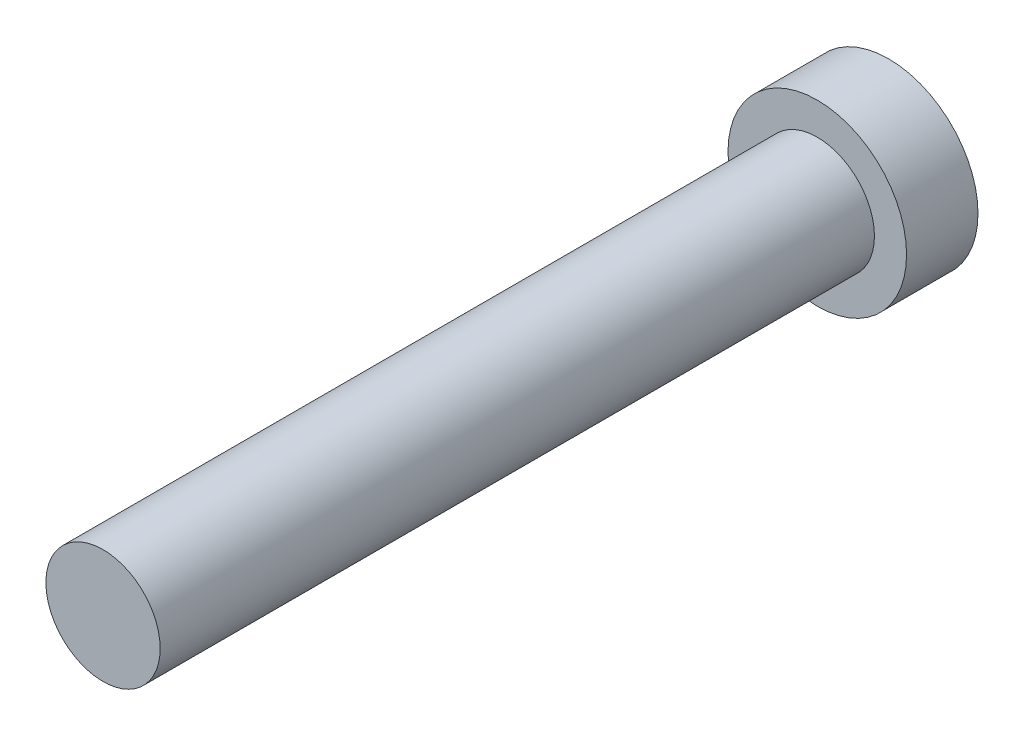
from build123d import *

# Parameters (mm, degrees)
SKETCH1_R           = 1.6
BOSS_EXTRUDE1_DEPTH = 10
SKETCH2_R           = 2.5
BOSS_EXTRUDE2_DEPTH = 2


with BuildPart() as part:
    # Sketch1 → Boss-Extrude1 (new, symmetric)
    with BuildSketch(Plane.XY):
        Circle(SKETCH1_R)
    extrude(amount=BOSS_EXTRUDE1_DEPTH, both=True)

    # Sketch2 → Boss-Extrude2 (add)
    with BuildSketch(Plane(origin=(0, 0, -10), x_dir=(-1, 0, 0), z_dir=(0, 0, -1))):
        Circle(SKETCH2_R)
    extrude(amount=BOSS_EXTRUDE2_DEPTH)


solid = part.part
